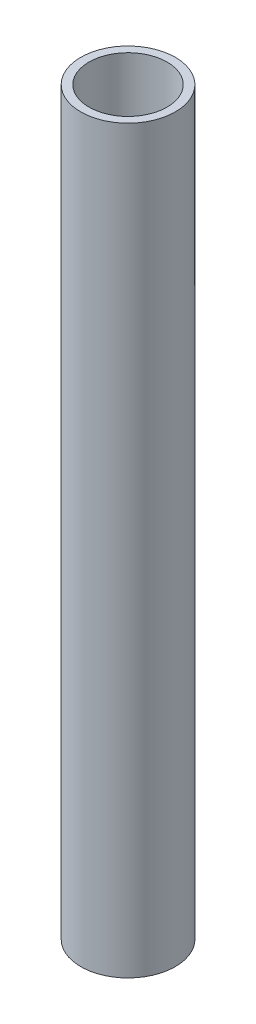
from build123d import *

# Parameters (mm, degrees)
SKETCH1_R           = 23
SKETCH1_R_2         = 19
BOSS_EXTRUDE1_DEPTH = 360


with BuildPart() as part:
    # Sketch1 → Boss-Extrude1 (new body)
    with BuildSketch(Plane(origin=(0, 0, 0), x_dir=(1, 0, 0), z_dir=(0, 1, 0))):
        with Locations(Location((0, 0, 0), (0, 0, 90))):
            Circle(SKETCH1_R)
        with Locations(Location((0, 0, 0), (0, 0, 90))):
            Circle(SKETCH1_R_2, mode=Mode.SUBTRACT)
    extrude(amount=BOSS_EXTRUDE1_DEPTH)


solid = part.part
